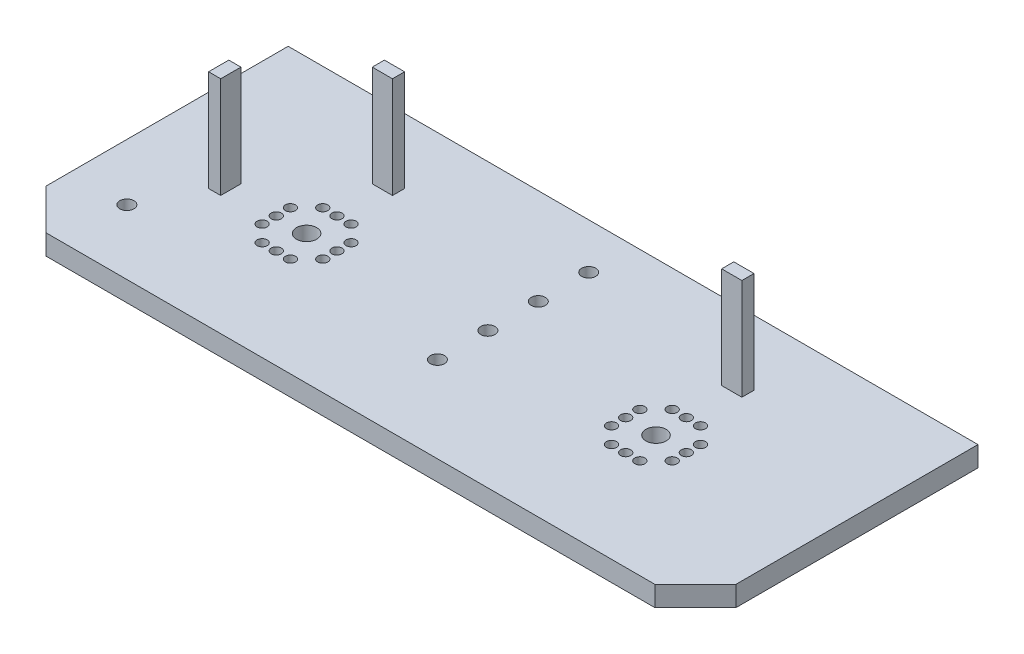
from build123d import *

# Parameters (mm, degrees)
SKETCH1_W           = 170.58
SKETCH1_H           = 69.88
BOSS_EXTRUDE1_DEPTH = 5
SKETCH6_R           = 1.25
CUT_EXTRUDE2_DEPTH  = 8
SKETCH7_R           = 1.75
CUT_EXTRUDE3_DEPTH  = 8
BOSS_EXTRUDE2_DEPTH = 25
SKETCH9_R           = 1.75
SKETCH9_R_2         = 1.749999999
CUT_EXTRUDE4_DEPTH  = 10
CUT_EXTRUDE5_DEPTH  = 10
SKETCH11_R          = 2.5
CUT_EXTRUDE6_DEPTH  = 10


with BuildPart() as part:
    # Sketch1 → Boss-Extrude1 (new body)
    with BuildSketch(Plane(origin=(0, 0, 0), x_dir=(1, 0, 0), z_dir=(0, 1, 0))):
        with Locations((12.23073352, -487.847955707)):
            Rectangle(SKETCH1_W, SKETCH1_H)
    extrude(amount=BOSS_EXTRUDE1_DEPTH)

    # Sketch6 → Cut-Extrude2 (cut)
    with BuildSketch(Plane(origin=(0, 5, 0), x_dir=(1, 0, 0), z_dir=(0, 1, 0))):
        with Locations(Location((-30.70426648, -483.202955707, 0), (0, 0, 270))):
            Circle(SKETCH6_R)
        with Locations(Location((-23.20426648, -490.702955707, 0), (0, 0, 270))):
            Circle(SKETCH6_R)
        with Locations(Location((-30.70426648, -498.202955707, 0), (0, 0, 270))):
            Circle(SKETCH6_R)
        with Locations(Location((-38.20426648, -490.702955707, 0), (0, 0, 270))):
            Circle(SKETCH6_R)
        with Locations(Location((-38.20426648, -487.202955707, 0), (0, 0, 270))):
            Circle(SKETCH6_R)
        with Locations(Location((-38.20426648, -494.202955707, 0), (0, 0, 270))):
            Circle(SKETCH6_R)
        with Locations(Location((-23.20426648, -487.202955707, 0), (0, 0, 270))):
            Circle(SKETCH6_R)
        with Locations(Location((-23.20426648, -494.202955707, 0), (0, 0, 270))):
            Circle(SKETCH6_R)
        with Locations(Location((-27.20426648, -498.202955707, 0), (0, 0, 270))):
            Circle(SKETCH6_R)
        with Locations(Location((-34.20426648, -498.202955707, 0), (0, 0, 270))):
            Circle(SKETCH6_R)
        with Locations(Location((-27.20426648, -483.202955707, 0), (0, 0, 270))):
            Circle(SKETCH6_R)
        with Locations(Location((-34.20426648, -483.202955707, 0), (0, 0, 270))):
            Circle(SKETCH6_R)
        with Locations(Location((55.69573352, -483.202955707, 0), (0, 0, 270))):
            Circle(SKETCH6_R)
        with Locations(Location((55.69573352, -498.202955707, 0), (0, 0, 270))):
            Circle(SKETCH6_R)
        with Locations(Location((63.19573352, -490.702955707, 0), (0, 0, 270))):
            Circle(SKETCH6_R)
        with Locations(Location((48.19573352, -490.702955707, 0), (0, 0, 270))):
            Circle(SKETCH6_R)
        with Locations(Location((59.19573352, -483.202955707, 0), (0, 0, 270))):
            Circle(SKETCH6_R)
        with Locations(Location((52.19573352, -483.202955707, 0), (0, 0, 270))):
            Circle(SKETCH6_R)
        with Locations(Location((48.19573352, -487.202955707, 0), (0, 0, 270))):
            Circle(SKETCH6_R)
        with Locations(Location((48.19573352, -494.202955707, 0), (0, 0, 270))):
            Circle(SKETCH6_R)
        with Locations(Location((59.19573352, -498.202955707, 0), (0, 0, 270))):
            Circle(SKETCH6_R)
        with Locations(Location((52.19573352, -498.202955707, 0), (0, 0, 270))):
            Circle(SKETCH6_R)
        with Locations(Location((63.19573352, -487.202955707, 0), (0, 0, 270))):
            Circle(SKETCH6_R)
        with Locations(Location((63.19573352, -494.202955707, 0), (0, 0, 270))):
            Circle(SKETCH6_R)
    extrude(amount=-CUT_EXTRUDE2_DEPTH, mode=Mode.SUBTRACT)

    # Sketch7 → Cut-Extrude3 (cut)
    with BuildSketch(Plane.XZ):
        with Locations(Location((12.49573352, 489.082955707, 0), (0, 0, 270))):
            Circle(SKETCH7_R)
        with Locations(Location((12.49573352, 501.552955707, 0), (0, 0, 270))):
            Circle(SKETCH7_R)
    extrude(amount=-CUT_EXTRUDE3_DEPTH, mode=Mode.SUBTRACT)

    # Sketch8 → Boss-Extrude2 (add)
    with BuildSketch(Plane(origin=(0, 5, 0), x_dir=(1, 0, 0), z_dir=(0, 1, 0))):
        Polygon((53.19573352, -471.967955707), (55.69573352, -471.967955707), (58.19573352, -471.967955707), (58.19573352, -468.967955707), (53.19573352, -468.967955707), align=None)
        Polygon((-33.20426648, -471.967955707), (-33.20426648, -468.967955707), (-30.70426648, -468.967955707), (-28.20426648, -468.967955707), (-28.20426648, -471.967955707), align=None)
        Polygon((-49.44426648, -493.202955707), (-49.44426648, -490.702955707), (-49.44426648, -488.202955707), (-52.44426648, -488.202955707), (-52.44426648, -493.202955707), align=None)
    extrude(amount=BOSS_EXTRUDE2_DEPTH)

    # Sketch9 → Cut-Extrude4 (cut)
    with BuildSketch(Plane(origin=(0, 5, 0), x_dir=(1, 0, 0), z_dir=(0, 1, 0))):
        with Locations(Location((12.49573352, -476.612955707, 0), (0, 0, 270))):
            Circle(SKETCH9_R)
        with Locations(Location((12.49573352, -464.142955707, 0), (0, 0, 270))):
            Circle(SKETCH9_R)
        with Locations(Location((-59.05926648, -506.787955707, 0), (0, 0, 270))):
            Circle(SKETCH9_R_2)
    extrude(amount=-CUT_EXTRUDE4_DEPTH, mode=Mode.SUBTRACT)

    # Sketch10 → Cut-Extrude5 (cut)
    with BuildSketch(Plane(origin=(0, 5, 0), x_dir=(1, 0, 0), z_dir=(0, 1, 0))):
        Polygon((-73.05926648, -522.787955707), (-73.05926648, -512.787955707), (-63.05926648, -522.787955707), align=None)
        Polygon((97.52073352, -522.787955707), (87.52073352, -522.787955707), (97.52073352, -512.787955707), align=None)
    extrude(amount=-CUT_EXTRUDE5_DEPTH, mode=Mode.SUBTRACT)

    # Sketch11 → Cut-Extrude6 (cut)
    with BuildSketch(Plane(origin=(0, 5, 0), x_dir=(1, 0, 0), z_dir=(0, 1, 0))):
        with Locations(Location((-30.70426648, -490.702955707, 0), (0, 0, 270))):
            Circle(SKETCH11_R)
        with Locations(Location((55.69573352, -490.702955707, 0), (0, 0, 270))):
            Circle(SKETCH11_R)
    extrude(amount=-CUT_EXTRUDE6_DEPTH, mode=Mode.SUBTRACT)


solid = part.part
